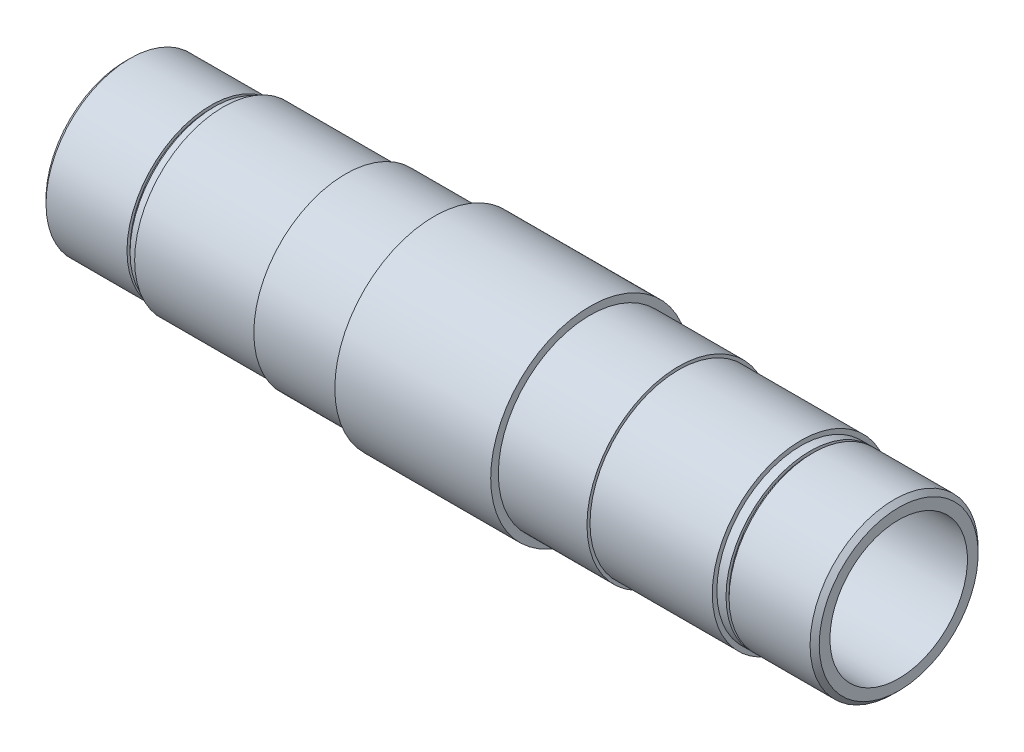
from build123d import *

# Parameters (mm, degrees)
CHAMFER1_SIZE = 1.5


with BuildPart() as part:
    # Sketch1 → Revolve1 (revolve)
    with BuildSketch(Plane.XY, mode=Mode.PRIVATE) as revolve1_sk:
        Polygon((0, 32.5), (-25.5, 32.5), (-25.5, 30), (-54.5, 30), (-54.5, 29), (-94.5, 29), (-94.5, 27.5), (-97.5, 27.5), (-97.5, 26.5), (-98.5, 26.5), (-98.5, 27.5), (-126.5, 27.5), (-126.5, 22.5), (0, 22.5), align=None)
    revolve1 = revolve(revolve1_sk.sketch.rotate(Axis((0, 0, 0), (1, 0, 0)), 90), axis=Axis((0, 0, 0), (1, 0, 0)))

    # Mirror1: Revolve1 across plane
    add(revolve1.mirror(Plane(origin=(0, 0, 0), x_dir=(0, 0, 1), z_dir=(1, 0, 0))))

    # Chamfer1
    chamfer1_edges = [part.edges().sort_by_distance(p)[0] for p in [
        (-126.5, 0, -27.5),
        (126.5, 0, -27.5),
    ]]
    chamfer(chamfer1_edges, length=CHAMFER1_SIZE)


solid = part.part
